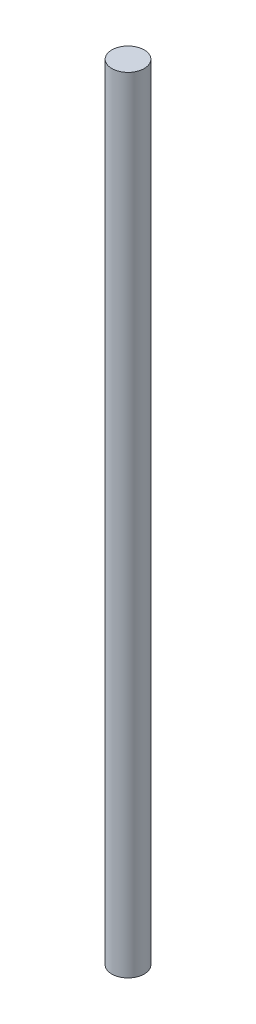
from build123d import *

# Parameters (mm, degrees)
SKETCH1_R           = 2
BOSS_EXTRUDE1_DEPTH = 97


with BuildPart() as part:
    # Sketch1 → Boss-Extrude1 (new body)
    with BuildSketch(Plane(origin=(0, 0, 0), x_dir=(1, 0, 0), z_dir=(0, 1, 0))):
        with Locations(Location((0, 0, 0), (0, 0, 90))):
            Circle(SKETCH1_R)
    extrude(amount=BOSS_EXTRUDE1_DEPTH)


solid = part.part
